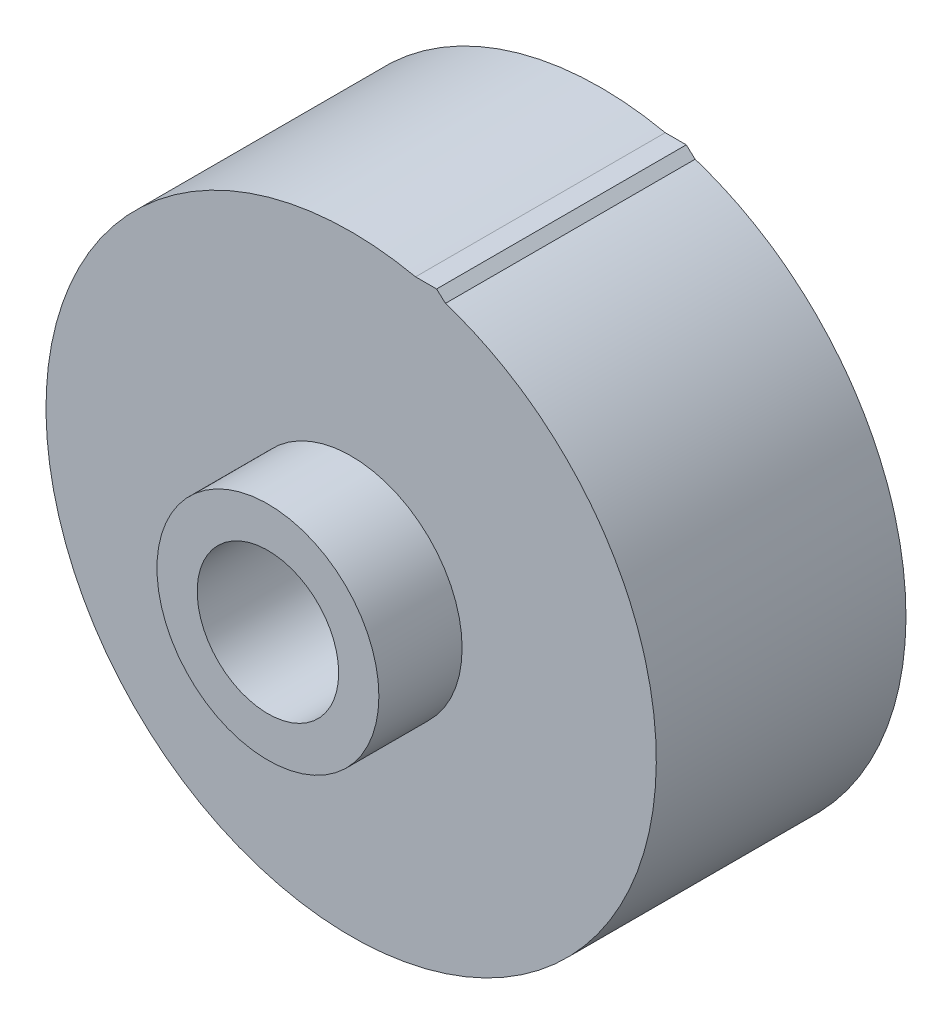
from build123d import *

# Parameters (mm, degrees)
SKETCH_1_R      = 8
SKETCH_1_R_2    = 5.1
EXTRUDE_1_DEPTH = 24
SKETCH_1_2_R    = 8
SKETCH_1_2_R_2  = 5.1
EXTRUDE_2_DEPTH = 24
SKETCH_2_R      = 22
SKETCH_2_R_2    = 8
EXTRUDE_3_DEPTH = 18
EXTRUDE_5_DEPTH = 18
EXTRUDE_6_DEPTH = 18
EXTRUDE_7_DEPTH = 18
EXTRUDE_8_DEPTH = 18


with BuildPart() as part:
    # 草图1 → 凸台-拉伸1 (new body)
    with BuildSketch(Plane.XY):
        Circle(SKETCH_1_R)
        Circle(SKETCH_1_R_2, mode=Mode.SUBTRACT)
    extrude(amount=EXTRUDE_1_DEPTH)

    # 草图1<2> → 凸台-拉伸2 (add)
    with BuildSketch(Plane.XY):
        Circle(SKETCH_1_2_R)
        Circle(SKETCH_1_2_R_2, mode=Mode.SUBTRACT)
    extrude(amount=EXTRUDE_2_DEPTH)

    # 草图2 → 凸台-拉伸3 (add)
    with BuildSketch(Plane.XY):
        Circle(SKETCH_2_R)
        Circle(SKETCH_2_R_2, mode=Mode.SUBTRACT)
    extrude(amount=EXTRUDE_3_DEPTH)

    # 草图4 → 凸台-拉伸5 (add)
    with BuildSketch(Plane.XY):
        with BuildLine():
            Line((16.379966987, 6.160087784), (20.591958498, 7.744110358))
            Line((20.591958498, 7.744110358), (20.762986314, 7.27312858))
            Line((20.762986314, 7.27312858), (20.923243358, 6.798373876))
            Line((20.923243358, 6.798373876), (21.072646499, 6.320092525))
            Line((21.072646499, 6.320092525), (21.211118232, 5.838532635))
            Line((21.211118232, 5.838532635), (16.872480412, 4.644287323))
            ThreePointArc((16.872480412, 4.644287323), (16.643489035, 5.407797402), (16.379966987, 6.160087784))
        make_face()
    extrude(amount=EXTRUDE_5_DEPTH)

    # 草图5 → 凸台-拉伸6 (add)
    with BuildSketch(Plane.XY):
        with BuildLine():
            Line((13.674702527, 10.920279795), (17.191054606, 13.728351742))
            Line((17.191054606, 13.728351742), (17.499253098, 13.333271955))
            Line((17.499253098, 13.333271955), (17.798373876, 12.93127555))
            Line((17.798373876, 12.93127555), (18.088261772, 12.522571065))
            Line((18.088261772, 12.522571065), (18.368766406, 12.107370512))
            Line((18.368766406, 12.107370512), (14.611518732, 9.630862907))
            ThreePointArc((14.611518732, 9.630862907), (14.157797402, 10.286241915), (13.674702527, 10.920279795))
        make_face()
    extrude(amount=EXTRUDE_6_DEPTH)

    # 草图6 → 凸台-拉伸7 (add)
    with BuildSketch(Plane.XY):
        with BuildLine():
            Line((9.630862907, 14.611518732), (12.107370512, 18.368766406))
            Line((12.107370512, 18.368766406), (12.522571065, 18.088261772))
            Line((12.522571065, 18.088261772), (12.93127555, 17.798373876))
            Line((12.93127555, 17.798373876), (13.333271955, 17.499253098))
            Line((13.333271955, 17.499253098), (13.728351742, 17.191054606))
            Line((13.728351742, 17.191054606), (10.920279795, 13.674702527))
            ThreePointArc((10.920279795, 13.674702527), (10.286241915, 14.157797402), (9.630862907, 14.611518732))
        make_face()
    extrude(amount=EXTRUDE_7_DEPTH)

    # 草图7 → 凸台-拉伸8 (add)
    with BuildSketch(Plane.XY):
        with BuildLine():
            Line((4.644287323, 16.872480412), (4.644287323, 21.50419948))
            Line((4.644287323, 21.50419948), (6.160087784, 21.50419948))
            Line((6.160087784, 21.50419948), (6.798373876, 20.923243358))
            Line((6.798373876, 20.923243358), (7.27312858, 20.762986314))
            Line((7.27312858, 20.762986314), (7.744110358, 20.591958498))
            Line((7.744110358, 20.591958498), (6.160087784, 16.379966987))
            ThreePointArc((6.160087784, 16.379966987), (5.407797402, 16.643489035), (4.644287323, 16.872480412))
        make_face()
    extrude(amount=EXTRUDE_8_DEPTH)


solid = part.part
